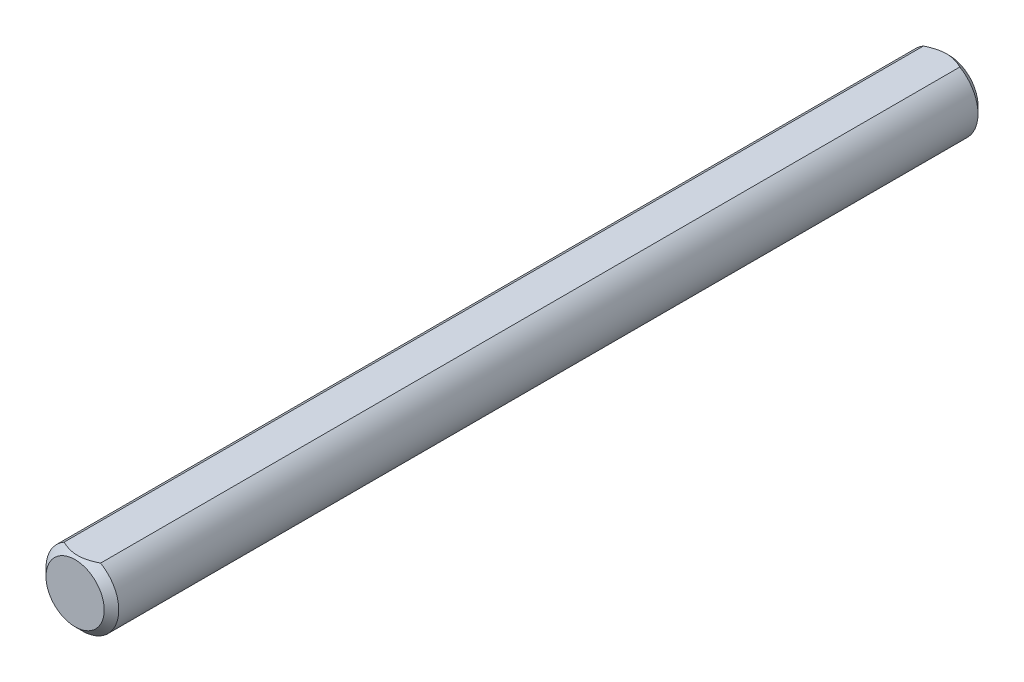
from build123d import *

# Parameters (mm, degrees)
SKETCH1_R           = 6.35
EXTRUDE1_DEPTH      = 76.2
CHAMFER1_SIZE       = 1.27
EXTRUDE7_DEPTH      = 77.727341932
EXTRUDE7_DEPTH_BACK = 77.727341932


with BuildPart() as part:
    # Sketch1 → Extrude1 (new, symmetric)
    with BuildSketch(Plane.XY):
        with Locations(Location((0, 0, 0), (0, 0, 180))):
            Circle(SKETCH1_R)
    extrude(amount=EXTRUDE1_DEPTH, both=True)

    # Chamfer1
    chamfer1_edges = [part.edges().sort_by_distance(p)[0] for p in [
        (6.35, 0, -76.2),
        (6.35, 0, 76.2),
    ]]
    chamfer(chamfer1_edges, length=CHAMFER1_SIZE)

    # Sketch13 → Extrude7 (cut, two sides: drawn at the far end of the back side and taken through both)
    with BuildSketch(Plane.XY.offset(-EXTRUDE7_DEPTH_BACK)):
        with BuildLine():
            Line((-3.175, 5.499261314), (3.175, 5.499261314))
            ThreePointArc((3.175, 5.499261314), (0, 6.35), (-3.175, 5.499261314))
        make_face()
    extrude(amount=EXTRUDE7_DEPTH + EXTRUDE7_DEPTH_BACK, mode=Mode.SUBTRACT)


solid = part.part
